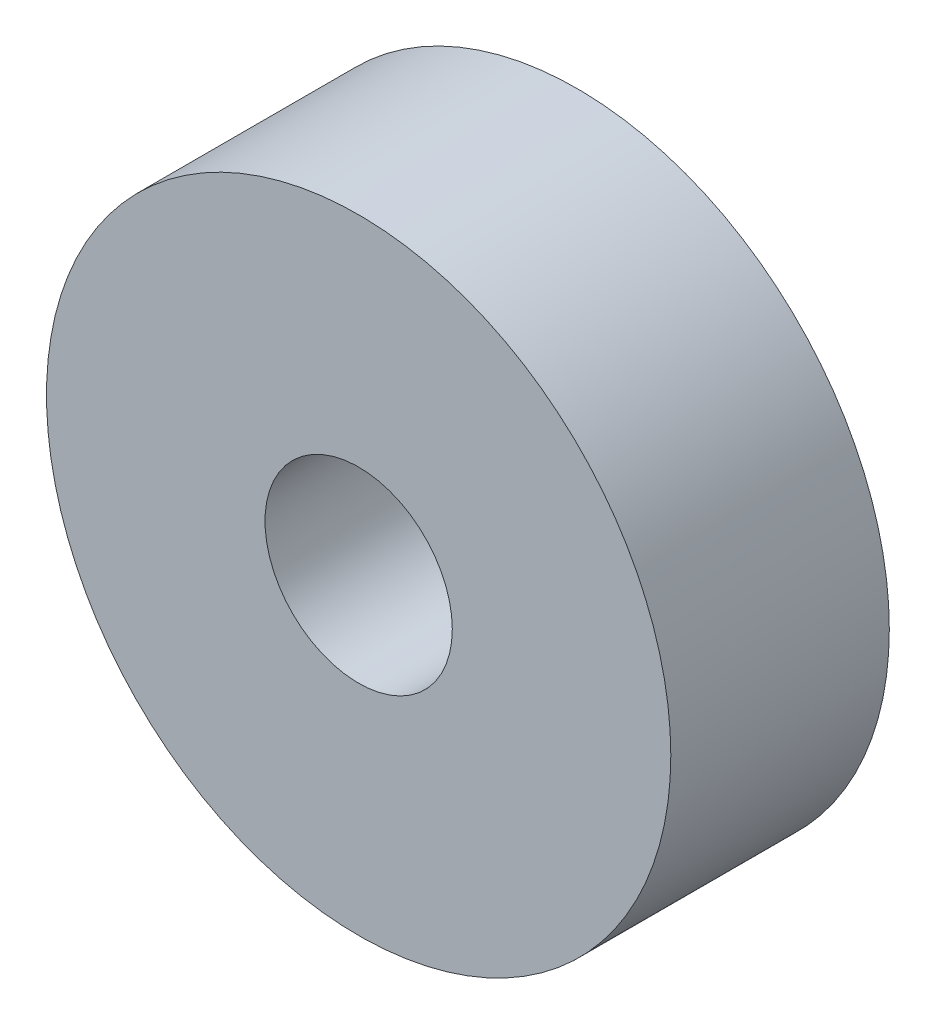
from build123d import *

# Parameters (mm, degrees)
SKETCH2_R           = 100
SKETCH2_R_2         = 30
BOSS_EXTRUDE1_DEPTH = 70


with BuildPart() as part:
    # Sketch2 → Boss-Extrude1 (new body)
    with BuildSketch(Plane.XY):
        with Locations((-60.068025197, 2.944511039)):
            Circle(SKETCH2_R)
        with Locations((-60.068025197, 2.944511039)):
            Circle(SKETCH2_R_2, mode=Mode.SUBTRACT)
    extrude(amount=BOSS_EXTRUDE1_DEPTH)


solid = part.part
